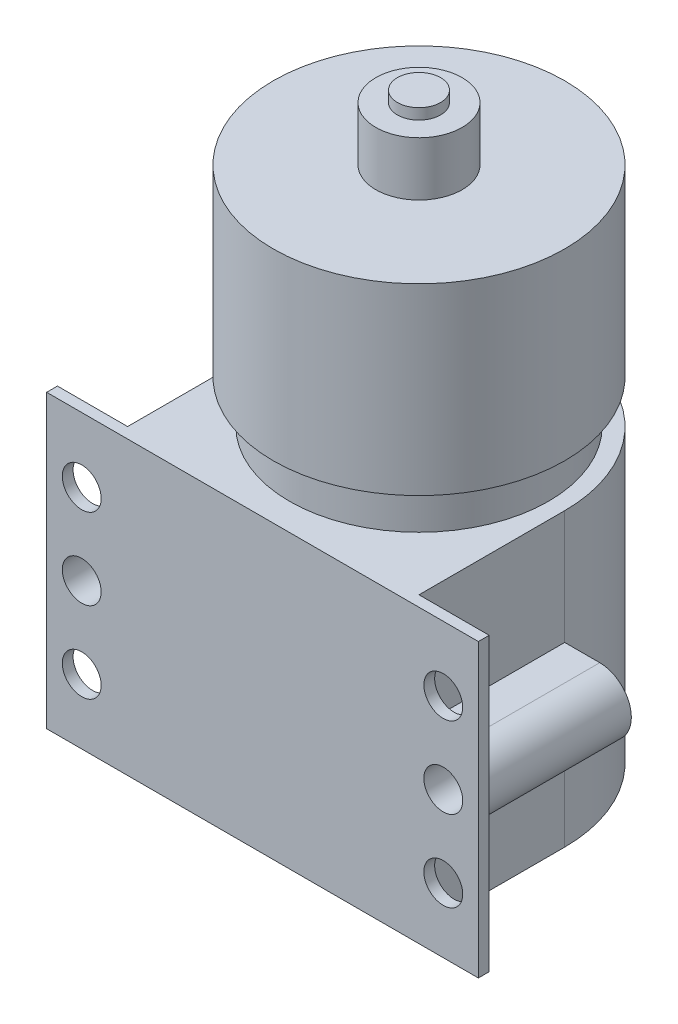
from build123d import *

# Parameters (mm, degrees)
SKETCH_1_R                   = 13.5
EXTRUDE_7_DEPTH              = 27
EXTRUDE_9_DEPTH              = 13.5
EXTRUDE_10_DEPTH             = 13.5
EXTRUDE_START                = -27
SKETCH_9_R                   = 12
EXTRUDE_11_DEPTH             = 4
EXTRUDE_START_2              = -31
SKETCH_10_R                  = 13.5
EXTRUDE_12_DEPTH             = 17
EXTRUDE_START_3              = -48
SKETCH_11_R                  = 4
EXTRUDE_13_DEPTH             = 5
EXTRUDE_START_4              = -53
SKETCH_12_R                  = 2
EXTRUDE_14_DEPTH             = 1
HOLE_WIZARD_M3_1_D           = 3.6
HOLE_WIZARD_M3_1_ON_FACE_2_D = 3.6


with BuildPart() as part:
    # ｽｹｯﾁ1 → ﾎﾞｽ - 押し出し7 (new body)
    with BuildSketch(Plane(origin=(0, 0, 0), x_dir=(1, 0, 0), z_dir=(0, 1, 0))):
        Circle(SKETCH_1_R)
        with BuildLine():
            Line((-13.5, -13.5), (0, -13.5))
            ThreePointArc((0, -13.5), (-9.545941546, -9.545941546), (-13.5, 0))
            Line((-13.5, 0), (-13.5, -13.5))
        make_face()
        with BuildLine():
            ThreePointArc((13.5, 0), (9.545941546, -9.545941546), (0, -13.5))
            Line((0, -13.5), (13.5, -13.5))
            Line((13.5, -13.5), (13.5, 0))
        make_face()
        Polygon((20, -13.5), (20, -14.5), (-20, -14.5), (-20, -13.5), (0, -13.5), align=None)
    extrude(amount=EXTRUDE_7_DEPTH)

    # ｽｹｯﾁ2 → ﾎﾞｽ - 押し出し9 (add)
    with BuildSketch(Plane(origin=(0, 0, 13.5), x_dir=(-1, 0, 0), z_dir=(0, 0, -1))):
        with BuildLine():
            Line((13.5, 10.575), (16.75, 10.575))
            ThreePointArc((16.75, 10.575), (19.675, 13.5), (16.75, 16.425))
            Line((16.75, 16.425), (13.5, 16.425))
            Line((13.5, 16.425), (13.5, 10.575))
        make_face()
    extrude(amount=EXTRUDE_9_DEPTH)

    # ｽｹｯﾁ3 → ﾎﾞｽ - 押し出し10 (add)
    with BuildSketch(Plane(origin=(0, 0, 13.5), x_dir=(-1, 0, 0), z_dir=(0, 0, -1))):
        with BuildLine():
            Line((-13.5, 16.425), (-16.75, 16.425))
            ThreePointArc((-16.75, 16.425), (-19.675, 13.5), (-16.75, 10.575))
            Line((-16.75, 10.575), (-13.5, 10.575))
            Line((-13.5, 10.575), (-13.5, 16.425))
        make_face()
    extrude(amount=EXTRUDE_10_DEPTH)

    # ｽｹｯﾁ9 → ﾎﾞｽ - 押し出し11 (add)
    with BuildSketch(Plane.XZ.offset(EXTRUDE_START)):
        with Locations(Location((0, 0, 0), (0, 0, 270))):
            Circle(SKETCH_9_R)
    extrude(amount=-EXTRUDE_11_DEPTH)

    # ｽｹｯﾁ10 → ﾎﾞｽ - 押し出し12 (add)
    with BuildSketch(Plane.XZ.offset(EXTRUDE_START_2)):
        with Locations(Location((0, 0, 0), (0, 0, 270))):
            Circle(SKETCH_10_R)
    extrude(amount=-EXTRUDE_12_DEPTH)

    # ｽｹｯﾁ11 → ﾎﾞｽ - 押し出し13 (add)
    with BuildSketch(Plane.XZ.offset(EXTRUDE_START_3)):
        with Locations(Location((0, 0, 0), (0, 0, 270))):
            Circle(SKETCH_11_R)
    extrude(amount=-EXTRUDE_13_DEPTH)

    # ｽｹｯﾁ12 → ﾎﾞｽ - 押し出し14 (add)
    with BuildSketch(Plane.XZ.offset(EXTRUDE_START_4)):
        with Locations(Location((0, 0, 0), (0, 0, 270))):
            Circle(SKETCH_12_R)
    extrude(amount=-EXTRUDE_14_DEPTH)

    # M3 すきま穴1 (through all)
    with Locations(Plane(origin=(16.75, 21, 13.5), x_dir=(-1, 0, 0), z_dir=(0, 0, -1))):
        with Locations((0, 0), (0, -15), (33.5, 0), (33.5, -15)):
            Hole(HOLE_WIZARD_M3_1_D / 2)

    # M3 すきま穴1 on face 2 (through all)
    with Locations(Plane(origin=(16.75, 13.5, 0), x_dir=(-1, 0, 0), z_dir=(0, 0, -1))):
        with Locations((0, 0), (33.5, 0)):
            Hole(HOLE_WIZARD_M3_1_ON_FACE_2_D / 2)


solid = part.part
